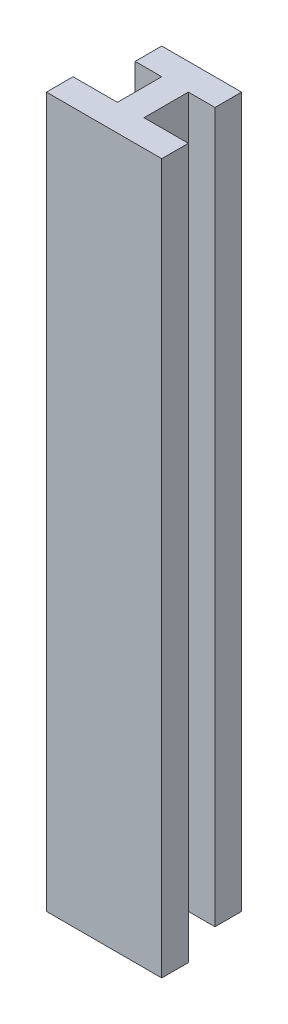
from build123d import *

# Parameters (mm, degrees)
EXTRUDE_1_DEPTH = 80


with BuildPart() as part:
    # 草图1 → 凸台-拉伸1 (new body)
    with BuildSketch(Plane(origin=(0, 0, 0), x_dir=(1, 0, 0), z_dir=(0, 1, 0))):
        Polygon((0, 0), (13, 0), (13, 3), (8, 3), (8, 8), (11, 8), (11, 11), (2, 11), (2, 8), (5, 8), (5, 3), (0, 3), align=None)
    extrude(amount=EXTRUDE_1_DEPTH)


solid = part.part
